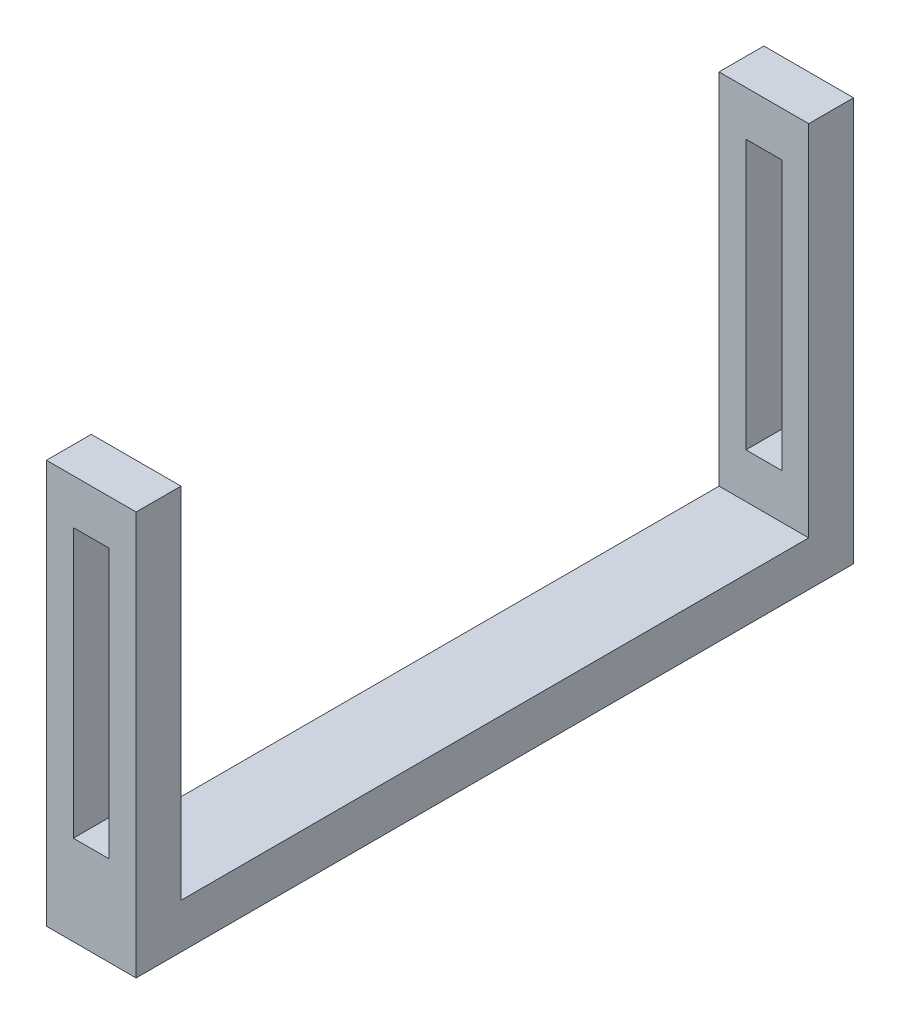
from build123d import *

# Parameters (mm, degrees)
ESBO_O1_W                = 20
ESBO_O1_H                = 80
ESBO_O1_W_2              = 8
ESBO_O1_H_2              = 60
RESSALTO_EXTRUS_O1_DEPTH = 10
ESBO_O1_4_W              = 20
ESBO_O1_4_H              = 10
RESSALTO_EXTRUS_O3_DEPTH = 80


with BuildPart() as part:
    # Esboço1 → Ressalto-extrusão1 (new body)
    with BuildSketch(Plane.XY):
        Rectangle(ESBO_O1_W, ESBO_O1_H)
        Rectangle(ESBO_O1_W_2, ESBO_O1_H_2, mode=Mode.SUBTRACT)
    ressalto_extrus_o1 = extrude(amount=RESSALTO_EXTRUS_O1_DEPTH)

    # Esboço1<4> → Ressalto-extrusão3 (add)
    with BuildSketch(Plane.XY):
        with Locations((0, -45)):
            Rectangle(ESBO_O1_4_W, ESBO_O1_4_H)
    ressalto_extrus_o3 = extrude(amount=RESSALTO_EXTRUS_O3_DEPTH)

    # Espelhar2: Ressalto-extrusão1, Ressalto-extrusão3 across plane
    add(ressalto_extrus_o1.mirror(Plane.XY.offset(80)))
    add(ressalto_extrus_o3.mirror(Plane.XY.offset(80)))


solid = part.part
